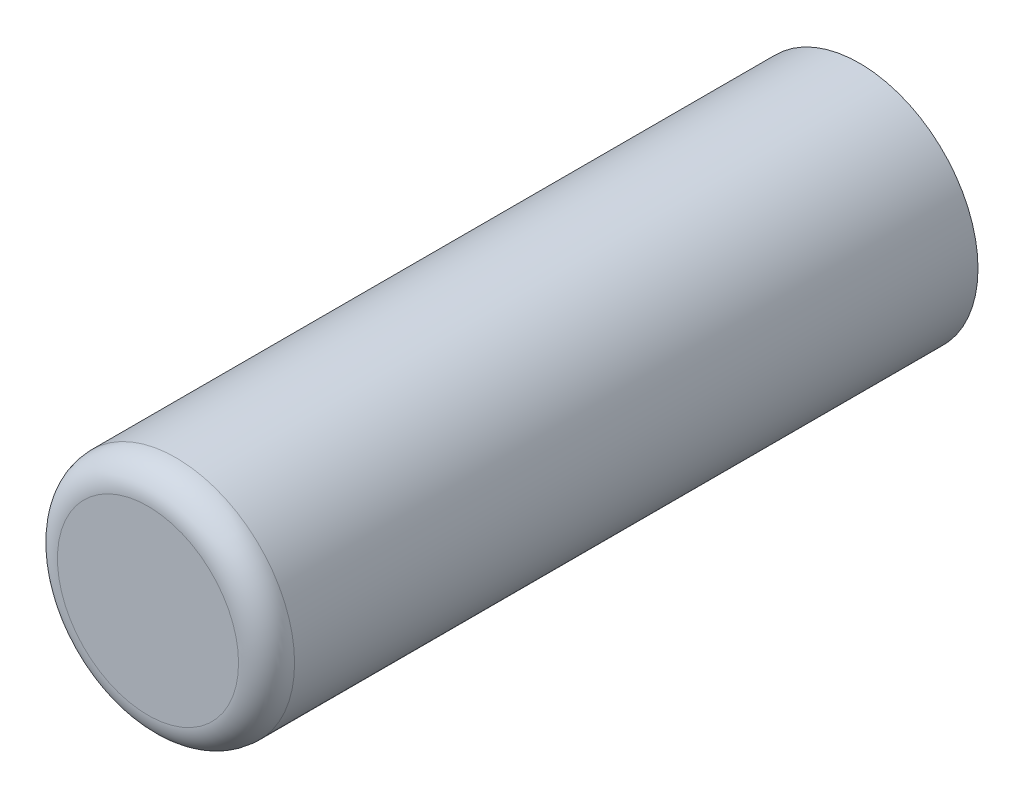
from build123d import *

# Parameters (mm, degrees)
SKETCH1_R           = 12.7
BOSS_EXTRUDE1_DEPTH = 76.2
FILLET1_R           = 3


with BuildPart() as part:
    # Sketch1 → Boss-Extrude1 (new body)
    with BuildSketch(Plane.XY):
        Circle(SKETCH1_R)
    extrude(amount=BOSS_EXTRUDE1_DEPTH)

    # Fillet1
    fillet1_edges = [part.edges().sort_by_distance(p)[0] for p in [
        (-12.7, 0, 76.2),
    ]]
    fillet(fillet1_edges, radius=FILLET1_R)


solid = part.part
